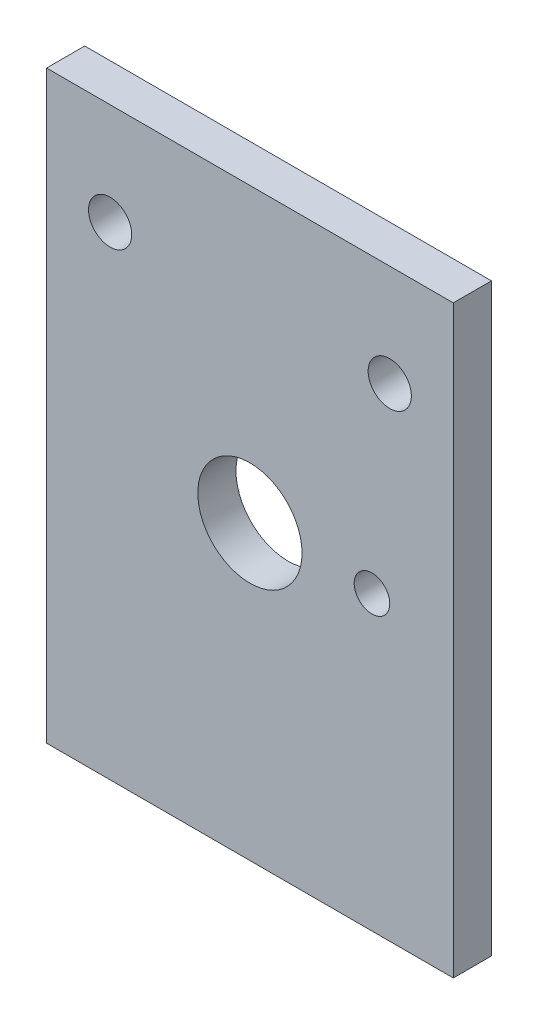
from build123d import *

# Parameters (mm, degrees)
SKETCH_1_W          = 32
SKETCH_1_H          = 46
EXTRUDE_1_DEPTH     = 3
SKETCH_2_R          = 4.1
SKETCH_2_R_2        = 1.4
CUT_EXTRUDE_1_DEPTH = 4
SKETCH_3_R          = 1.7
CUT_EXTRUDE_2_DEPTH = 4


with BuildPart() as part:
    # 草图1 → 凸台-拉伸1 (new body)
    with BuildSketch(Plane.XY):
        Rectangle(SKETCH_1_W, SKETCH_1_H)
    extrude(amount=-EXTRUDE_1_DEPTH)

    # 草图2 → 切除-拉伸1 (cut)
    with BuildSketch(Plane.XY):
        Circle(SKETCH_2_R)
        with Locations((9.6, 0)):
            Circle(SKETCH_2_R_2)
    extrude(amount=-CUT_EXTRUDE_1_DEPTH, mode=Mode.SUBTRACT)

    # 草图3 → 切除-拉伸2 (cut)
    with BuildSketch(Plane.XY):
        with Locations((-11, 15)):
            Circle(SKETCH_3_R)
        with Locations((11, 15)):
            Circle(SKETCH_3_R)
    extrude(amount=-CUT_EXTRUDE_2_DEPTH, mode=Mode.SUBTRACT)


solid = part.part
